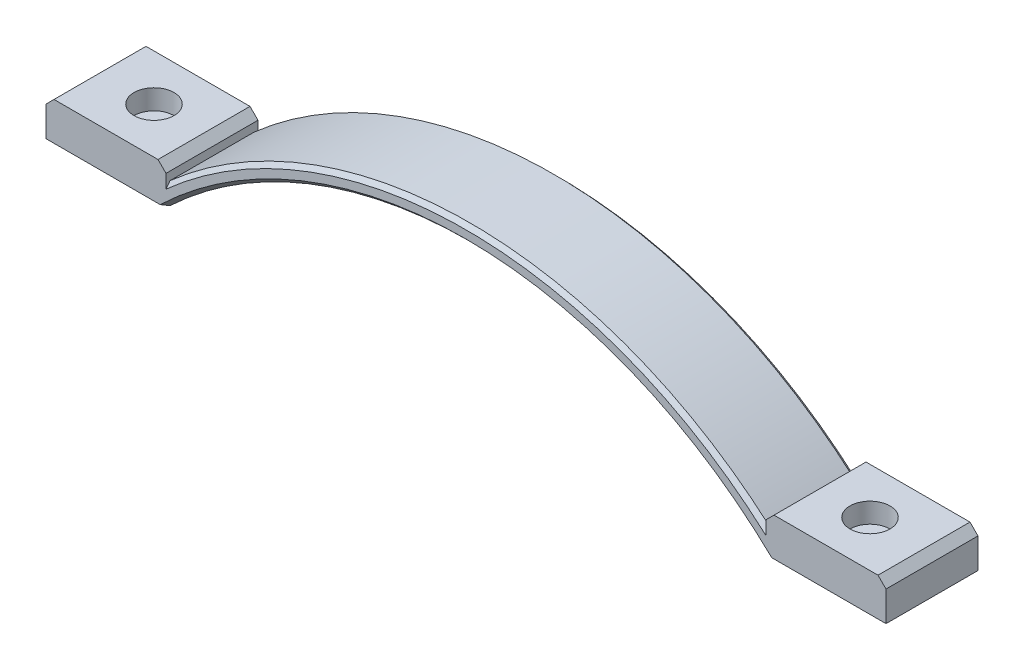
from build123d import *

# Parameters (mm, degrees)
EXTRUDE_1_DEPTH      = 11.5
EXTRUDE_1_DEPTH_BACK = 11.5
SKETCH_2_R           = 5
CUT_EXTRUDE_1_DEPTH  = 5
CHAMFER_1_SIZE       = 1
CHAMFER_2_SIZE       = 2


with BuildPart() as part:
    # 草图1 → 凸台-拉伸1 (new, two sides: drawn at the far end of the back side and taken through both)
    with BuildSketch(Plane.XY.offset(-EXTRUDE_1_DEPTH_BACK)):
        with BuildLine():
            Line((-105, 0), (-75, 0))
            ThreePointArc((-75, 0), (0, 29.784938454), (75, 0))
            Line((75, 0), (105, 0))
            Line((105, 0), (105, 9.5))
            Line((105, 9.5), (75, 9.5))
            Line((75, 9.5), (75, 5.414263011))
            ThreePointArc((75, 5.414263011), (0, 33.784938454), (-75, 5.414263011))
            Line((-75, 5.414263011), (-75, 9.5))
            Line((-75, 9.5), (-105, 9.5))
            Line((-105, 9.5), (-105, 0))
        make_face()
    extrude(amount=EXTRUDE_1_DEPTH + EXTRUDE_1_DEPTH_BACK)

    # 草图2 → 切除-拉伸1 (cut)
    with BuildSketch(Plane(origin=(0, 9.5, 0), x_dir=(1, 0, 0), z_dir=(0, 1, 0))):
        with Locations((-89.5, 0)):
            Circle(SKETCH_2_R)
        with Locations((89.5, 0)):
            Circle(SKETCH_2_R)
    extrude(amount=-CUT_EXTRUDE_1_DEPTH, mode=Mode.SUBTRACT)

    # 倒角1
    chamfer_1_edges = [part.edges().sort_by_distance(p)[0] for p in [
        (0, 29.784938454, 11.5),
        (0, 29.784938454, -11.5),
        (0, 33.784938454, -11.5),
        (0, 33.784938454, 11.5),
    ]]
    chamfer(chamfer_1_edges, length=CHAMFER_1_SIZE)

    # 倒角2
    chamfer_2_edges = [part.edges().sort_by_distance(p)[0] for p in [
        (-105, 9.5, 0),
        (-75, 9.5, 0),
        (75, 9.5, 0),
        (105, 9.5, 0),
    ]]
    chamfer(chamfer_2_edges, length=CHAMFER_2_SIZE)


solid = part.part
